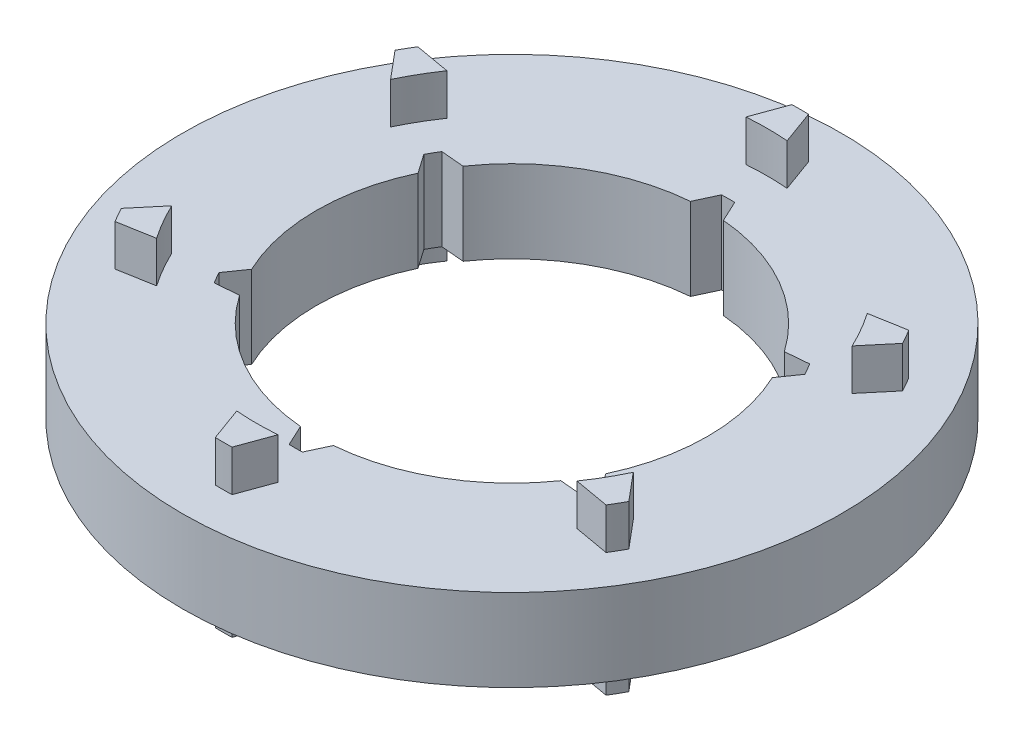
from build123d import *

# Parameters (mm, degrees)
SKETCH1_R           = 40
BOSS_EXTRUDE1_DEPTH = 10
BOSS_EXTRUDE4_START = -10
BOSS_EXTRUDE4_DEPTH = 5
BOSS_EXTRUDE5_START = 5
BOSS_EXTRUDE5_DEPTH = 5


with BuildPart() as part:
    # Sketch1 → Boss-Extrude1 (new body)
    with BuildSketch(Plane(origin=(0, 0, 0), x_dir=(1, 0, 0), z_dir=(0, 1, 0))):
        with Locations(Location((0, 0, 0), (0, 0, 270))):
            Circle(SKETCH1_R)
        with BuildLine():
            Line((-2, 23.665639649), (-0.800587161, 26.237788783))
            ThreePointArc((-0.800587161, 26.237788783), (0, 26.25), (0.800587161, 26.237788783))
            Line((0.800587161, 26.237788783), (2, 23.665639649))
            ThreePointArc((2, 23.665639649), (11.875, 20.56810334), (19.495045133, 13.564870632))
            Line((19.495045133, 13.564870632), (22.322298044, 13.812223211))
            ThreePointArc((22.322298044, 13.812223211), (22.733166849, 13.125), (23.122885205, 12.425565572))
            Line((23.122885205, 12.425565572), (21.495045133, 10.100769017))
            ThreePointArc((21.495045133, 10.100769017), (23.75, 0), (21.495045133, -10.100769017))
            Line((21.495045133, -10.100769017), (23.122885205, -12.425565572))
            ThreePointArc((23.122885205, -12.425565572), (22.733166849, -13.125), (22.322298044, -13.812223211))
            Line((22.322298044, -13.812223211), (19.495045133, -13.564870632))
            ThreePointArc((19.495045133, -13.564870632), (11.875, -20.56810334), (2, -23.665639649))
            Line((2, -23.665639649), (0.800587161, -26.237788783))
            ThreePointArc((0.800587161, -26.237788783), (0, -26.25), (-0.800587161, -26.237788783))
            Line((-0.800587161, -26.237788783), (-2, -23.665639649))
            ThreePointArc((-2, -23.665639649), (-11.875, -20.56810334), (-19.495045133, -13.564870632))
            Line((-19.495045133, -13.564870632), (-22.322298044, -13.812223211))
            ThreePointArc((-22.322298044, -13.812223211), (-22.733166849, -13.125), (-23.122885205, -12.425565572))
            Line((-23.122885205, -12.425565572), (-21.495045133, -10.100769017))
            ThreePointArc((-21.495045133, -10.100769017), (-23.75, 0), (-21.495045133, 10.100769017))
            Line((-21.495045133, 10.100769017), (-23.122885205, 12.425565572))
            ThreePointArc((-23.122885205, 12.425565572), (-22.733166849, 13.125), (-22.322298044, 13.812223211))
            Line((-22.322298044, 13.812223211), (-19.495045133, 13.564870632))
            ThreePointArc((-19.495045133, 13.564870632), (-11.875, 20.56810334), (-2, 23.665639649))
        make_face(mode=Mode.SUBTRACT)
    extrude(amount=BOSS_EXTRUDE1_DEPTH)

    # 1,2,3 → Boss-Extrude4 (add)
    with BuildSketch(Plane(origin=(0, 10, 0), x_dir=(1, 0, 0), z_dir=(0, 1, 0)).offset(BOSS_EXTRUDE4_START)):
        with BuildLine():
            Line((2.5, 30.899029111), (1.012702288, 34.985345991))
            ThreePointArc((1.012702288, 34.985345991), (0, 35), (-1.012702288, 34.985345991))
            Line((-1.012702288, 34.985345991), (-2.5, 30.899029111))
            ThreePointArc((-2.5, 30.899029111), (0, 31), (2.5, 30.899029111))
        make_face()
        with BuildLine():
            Line((25.509344162, 17.614578065), (29.791847244, 18.369698903))
            ThreePointArc((29.791847244, 18.369698903), (30.310889132, 17.5), (30.804549532, 16.615647087))
            Line((30.804549532, 16.615647087), (28.009344162, 13.284451046))
            ThreePointArc((28.009344162, 13.284451046), (26.846787517, 15.5), (25.509344162, 17.614578065))
        make_face()
        with BuildLine():
            Line((28.009344162, -13.284451046), (30.804549532, -16.615647087))
            ThreePointArc((30.804549532, -16.615647087), (30.310889132, -17.5), (29.791847244, -18.369698903))
            Line((29.791847244, -18.369698903), (25.509344162, -17.614578065))
            ThreePointArc((25.509344162, -17.614578065), (26.846787517, -15.5), (28.009344162, -13.284451046))
        make_face()
        with BuildLine():
            Line((2.5, -30.899029111), (1.012702288, -34.985345991))
            ThreePointArc((1.012702288, -34.985345991), (0, -35), (-1.012702288, -34.985345991))
            Line((-1.012702288, -34.985345991), (-2.5, -30.899029111))
            ThreePointArc((-2.5, -30.899029111), (0, -31), (2.5, -30.899029111))
        make_face()
        with BuildLine():
            Line((-25.509344162, -17.614578065), (-29.791847244, -18.369698903))
            ThreePointArc((-29.791847244, -18.369698903), (-30.310889132, -17.5), (-30.804549532, -16.615647087))
            Line((-30.804549532, -16.615647087), (-28.009344162, -13.284451046))
            ThreePointArc((-28.009344162, -13.284451046), (-26.846787517, -15.5), (-25.509344162, -17.614578065))
        make_face()
        with BuildLine():
            Line((-28.009344162, 13.284451046), (-30.804549532, 16.615647087))
            ThreePointArc((-30.804549532, 16.615647087), (-30.310889132, 17.5), (-29.791847244, 18.369698903))
            Line((-29.791847244, 18.369698903), (-25.509344162, 17.614578065))
            ThreePointArc((-25.509344162, 17.614578065), (-26.846787517, 15.5), (-28.009344162, 13.284451046))
        make_face()
    extrude(amount=-BOSS_EXTRUDE4_DEPTH)

    # 1,2,3<2> → Boss-Extrude5 (add)
    with BuildSketch(Plane(origin=(0, 10, 0), x_dir=(1, 0, 0), z_dir=(0, 1, 0)).offset(BOSS_EXTRUDE5_START)):
        with BuildLine():
            Line((2.5, 30.899029111), (1.012702288, 34.985345991))
            ThreePointArc((1.012702288, 34.985345991), (0, 35), (-1.012702288, 34.985345991))
            Line((-1.012702288, 34.985345991), (-2.5, 30.899029111))
            ThreePointArc((-2.5, 30.899029111), (0, 31), (2.5, 30.899029111))
        make_face()
        with BuildLine():
            Line((25.509344162, 17.614578065), (29.791847244, 18.369698903))
            ThreePointArc((29.791847244, 18.369698903), (30.310889132, 17.5), (30.804549532, 16.615647087))
            Line((30.804549532, 16.615647087), (28.009344162, 13.284451046))
            ThreePointArc((28.009344162, 13.284451046), (26.846787517, 15.5), (25.509344162, 17.614578065))
        make_face()
        with BuildLine():
            Line((28.009344162, -13.284451046), (30.804549532, -16.615647087))
            ThreePointArc((30.804549532, -16.615647087), (30.310889132, -17.5), (29.791847244, -18.369698903))
            Line((29.791847244, -18.369698903), (25.509344162, -17.614578065))
            ThreePointArc((25.509344162, -17.614578065), (26.846787517, -15.5), (28.009344162, -13.284451046))
        make_face()
        with BuildLine():
            Line((2.5, -30.899029111), (1.012702288, -34.985345991))
            ThreePointArc((1.012702288, -34.985345991), (0, -35), (-1.012702288, -34.985345991))
            Line((-1.012702288, -34.985345991), (-2.5, -30.899029111))
            ThreePointArc((-2.5, -30.899029111), (0, -31), (2.5, -30.899029111))
        make_face()
        with BuildLine():
            Line((-25.509344162, -17.614578065), (-29.791847244, -18.369698903))
            ThreePointArc((-29.791847244, -18.369698903), (-30.310889132, -17.5), (-30.804549532, -16.615647087))
            Line((-30.804549532, -16.615647087), (-28.009344162, -13.284451046))
            ThreePointArc((-28.009344162, -13.284451046), (-26.846787517, -15.5), (-25.509344162, -17.614578065))
        make_face()
        with BuildLine():
            Line((-28.009344162, 13.284451046), (-30.804549532, 16.615647087))
            ThreePointArc((-30.804549532, 16.615647087), (-30.310889132, 17.5), (-29.791847244, 18.369698903))
            Line((-29.791847244, 18.369698903), (-25.509344162, 17.614578065))
            ThreePointArc((-25.509344162, 17.614578065), (-26.846787517, 15.5), (-28.009344162, 13.284451046))
        make_face()
    extrude(amount=-BOSS_EXTRUDE5_DEPTH)


solid = part.part
